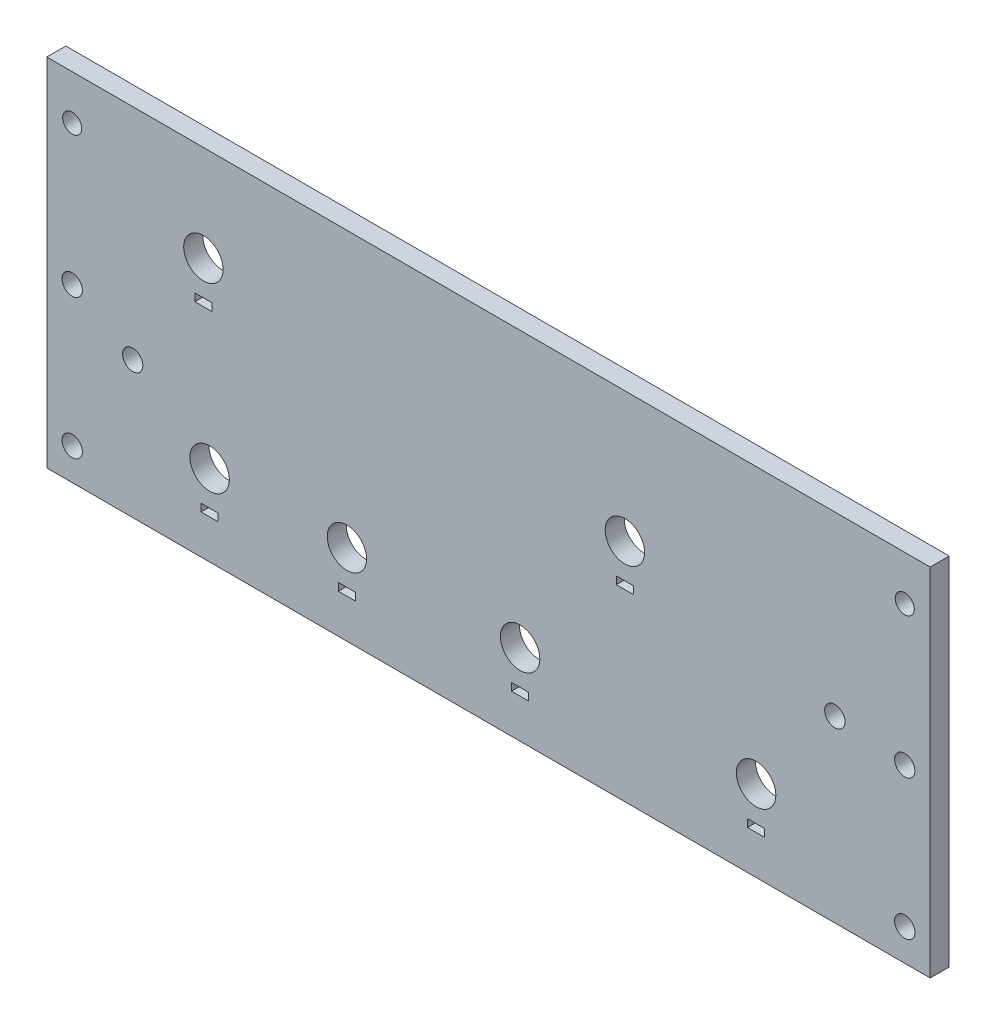
from build123d import *

# Parameters (mm, degrees)
SKETCH1_W           = 139
SKETCH1_H           = 56
SKETCH1_R           = 1.6
SKETCH1_R_2         = 3.1
SKETCH1_R_3         = 1.5
SKETCH1_W_2         = 2.7
SKETCH1_H_2         = 1.2
BOSS_EXTRUDE1_DEPTH = 3


with BuildPart() as part:
    # Sketch1 → Boss-Extrude1 (new body)
    with BuildSketch(Plane.XY):
        with Locations((69.5, 28)):
            Rectangle(SKETCH1_W, SKETCH1_H)
        with Locations((4, 27)):
            Circle(SKETCH1_R, mode=Mode.SUBTRACT)
        with Locations((135, 27)):
            Circle(SKETCH1_R, mode=Mode.SUBTRACT)
        with Locations((135, 5)):
            Circle(SKETCH1_R, mode=Mode.SUBTRACT)
        with Locations((4, 5)):
            Circle(SKETCH1_R, mode=Mode.SUBTRACT)
        with Locations((13.518505835, 21.5)):
            Circle(SKETCH1_R, mode=Mode.SUBTRACT)
        with Locations((124, 28.19419762)):
            Circle(SKETCH1_R, mode=Mode.SUBTRACT)
        with Locations((24.645602403, 40.906620861)):
            Circle(SKETCH1_R_2, mode=Mode.SUBTRACT)
        with Locations((25.62333913, 12.743937624)):
            Circle(SKETCH1_R_2, mode=Mode.SUBTRACT)
        with Locations((111.612884483, 12.743937624)):
            Circle(SKETCH1_R_2, mode=Mode.SUBTRACT)
        with Locations((90.966366944, 35.5)):
            Circle(SKETCH1_R_2, mode=Mode.SUBTRACT)
        with Locations((74.480236578, 12.743937624)):
            Circle(SKETCH1_R_2, mode=Mode.SUBTRACT)
        with Locations((47.230023053, 12.743937624)):
            Circle(SKETCH1_R_2, mode=Mode.SUBTRACT)
        with Locations((4, 49)):
            Circle(SKETCH1_R_3, mode=Mode.SUBTRACT)
        with Locations((135, 49)):
            Circle(SKETCH1_R_3, mode=Mode.SUBTRACT)
        with Locations((24.645602403, 34.906620861)):
            Rectangle(SKETCH1_W_2, SKETCH1_H_2, mode=Mode.SUBTRACT)
        with Locations((25.62333913, 6.743937624)):
            Rectangle(SKETCH1_W_2, SKETCH1_H_2, mode=Mode.SUBTRACT)
        with Locations((111.612884483, 6.743937624)):
            Rectangle(SKETCH1_W_2, SKETCH1_H_2, mode=Mode.SUBTRACT)
        with Locations((90.966366944, 29.5)):
            Rectangle(SKETCH1_W_2, SKETCH1_H_2, mode=Mode.SUBTRACT)
        with Locations((74.480236578, 6.743937624)):
            Rectangle(SKETCH1_W_2, SKETCH1_H_2, mode=Mode.SUBTRACT)
        with Locations((47.230023053, 6.743937624)):
            Rectangle(SKETCH1_W_2, SKETCH1_H_2, mode=Mode.SUBTRACT)
    extrude(amount=BOSS_EXTRUDE1_DEPTH)


solid = part.part
